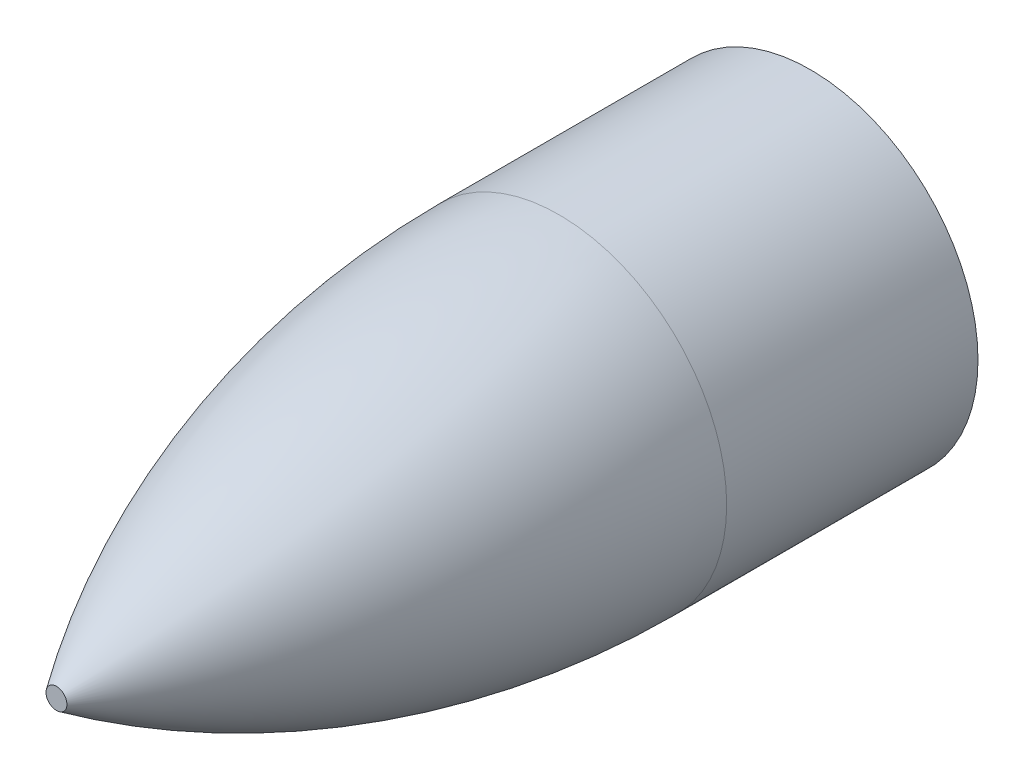
from build123d import *

# Parameters (mm, degrees)
SKETCH4_R           = 11.2395
CUT_EXTRUDE1_DEPTH  = 9.525
SKETCH5_W           = 2.921
SKETCH5_H           = 2.921
BOSS_EXTRUDE1_DEPTH = 1.8415


with BuildPart() as part:
    # Sketch3 → Revolve2 (revolve)
    with BuildSketch(Plane(origin=(0, 0, 0), x_dir=(0, 0, -1), z_dir=(1, 0, 0)), mode=Mode.PRIVATE) as revolve2_sk:
        with BuildLine():
            Line((0, 0), (38.1, 0))
            ThreePointArc((38.1, 0), (40.889807909, 6.735192091), (47.625, 9.525))
            Line((47.625, 9.525), (57.15, 9.525))
            Line((57.15, 9.525), (57.15, 12.7))
            Line((57.15, 12.7), (38.1, 12.7))
            ThreePointArc((38.1, 12.7), (18.1414881, 9.65411308), (0, 0.79375))
            Line((0, 0.79375), (0, 0))
        make_face()
    revolve(revolve2_sk.sketch.rotate(Axis((0, 0, 0), (0, 0, -1)), 90), axis=Axis((0, 0, 0), (0, 0, -1)))

    # Sketch4 → Cut-Extrude1 (cut)
    with BuildSketch(Plane(origin=(0, 0, -57.15), x_dir=(-1, 0, 0), z_dir=(0, 0, -1))):
        Circle(SKETCH4_R)
    extrude(amount=-CUT_EXTRUDE1_DEPTH, mode=Mode.SUBTRACT)

    # Sketch5 → Boss-Extrude1 (add)
    with BuildSketch(Plane(origin=(0, 11.43, 0), x_dir=(1, 0, 0), z_dir=(0, 1, 0))):
        with Locations((0, 55.6895)):
            Rectangle(SKETCH5_W, SKETCH5_H)
    boss_extrude1 = extrude(amount=-BOSS_EXTRUDE1_DEPTH)

    # Mirror1: Boss-Extrude1 across plane
    add(boss_extrude1.mirror(Plane.ZX))


solid = part.part
